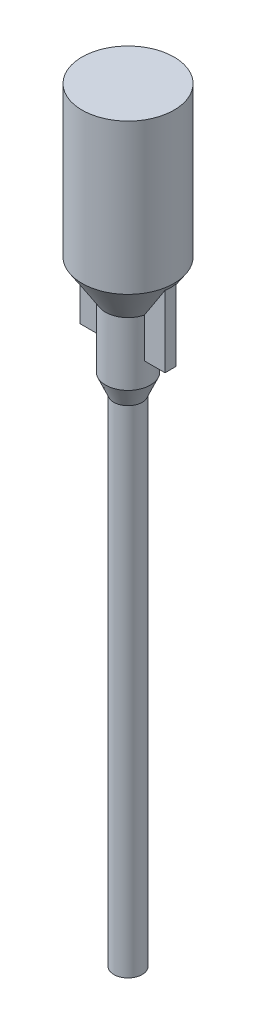
from build123d import *

# Parameters (mm, degrees)
SKETCH1_W           = 1
SKETCH1_H           = 35
SHELL1_T            = -0.15
SKETCH2_W           = 6
SKETCH2_H           = 0.77
BOSS_EXTRUDE1_DEPTH = 16


with BuildPart() as part:
    # Sketch1 → Revolve1 (revolve)
    with BuildSketch(Plane.XY, mode=Mode.PRIVATE) as revolve1_sk:
        Polygon((0, 40.8), (1.585, 40.8), (3.25, 43.4), (3.25, 54), (0, 54), align=None)
        Polygon((0, 35), (1, 35), (1.585, 36.35), (1.585, 40.8), (0, 40.8), align=None)
        with Locations((0.5, 17.5)):
            Rectangle(SKETCH1_W, SKETCH1_H)
    revolve(revolve1_sk.sketch.rotate(Axis((0, 40.8, 0), (0, 1, 0)), 90), axis=Axis((0, 40.8, 0), (0, 1, 0)))

    # Shell1
    shell1_openings = [part.faces().sort_by_distance(p)[0] for p in [
        (0, 0, 0),
    ]]
    offset(amount=SHELL1_T, openings=shell1_openings, kind=Kind.INTERSECTION)

    # Sketch2 → Boss-Extrude1 (add)
    with BuildSketch(Plane(origin=(0, 54, 0), x_dir=(1, 0, 0), z_dir=(0, 1, 0))):
        Rectangle(SKETCH2_W, SKETCH2_H)
    extrude(amount=-BOSS_EXTRUDE1_DEPTH)


solid = part.part
